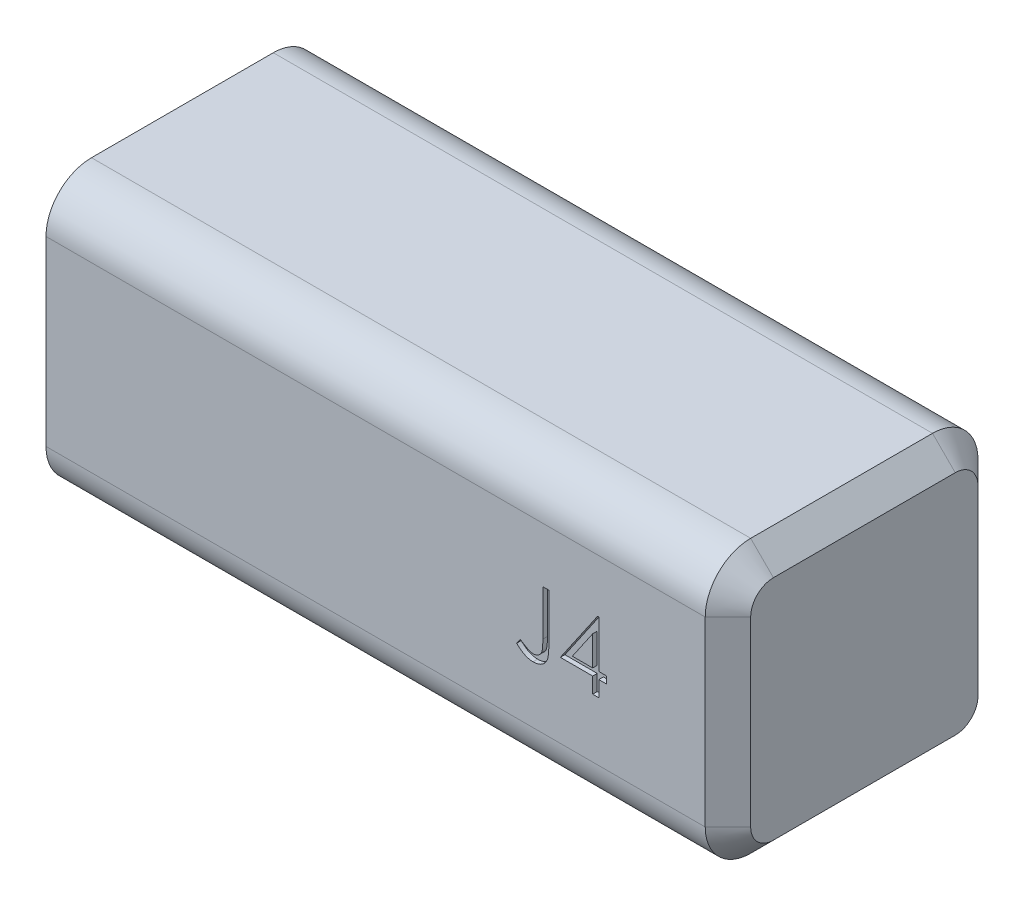
from build123d import *

# Parameters (mm, degrees)
BOSS_EXTRUDE1_DEPTH      = 30
BOSS_EXTRUDE1_DEPTH_BACK = 30
SKETCH1_W                = 150
SKETCH1_H                = 60
FILLET1_R                = 10
CHAMFER1_SIZE            = 5
CUT_EXTRUDE1_DEPTH       = 1
SKETCH14_R               = 22.5
CUT_EXTRUDE5_DEPTH       = 100


with BuildPart() as part:
    # Sketch1 → Boss-Extrude1 (new, two sides: drawn at the far end of the back side and taken through both)
    with BuildSketch(Plane.XY.offset(-BOSS_EXTRUDE1_DEPTH_BACK)):
        Rectangle(SKETCH1_W, SKETCH1_H)
    extrude(amount=BOSS_EXTRUDE1_DEPTH + BOSS_EXTRUDE1_DEPTH_BACK)

    # Fillet1
    fillet1_edges = [part.edges().sort_by_distance(p)[0] for p in [
        (0, -30, -30),
        (0, -30, 30),
        (0, 30, 30),
        (0, 30, -30),
    ]]
    fillet(fillet1_edges, radius=FILLET1_R)

    # Chamfer1
    chamfer1_edges = [part.edges().sort_by_distance(p)[0] for p in [
        (75, -30, 0),
        (75, -27.071067812, -27.071067812),
        (75, -27.071067812, 27.071067812),
        (75, 0, -30),
        (75, 0, 30),
        (75, 27.071067812, -27.071067812),
        (75, 27.071067812, 27.071067812),
        (75, 30, 0),
    ]]
    chamfer(chamfer1_edges, length=CHAMFER1_SIZE)

    # Sketch4 → Cut-Extrude1 (cut)
    # profile 1 of 2: a face of its own
    with BuildSketch(Plane.XY.offset(30)):
        with BuildLine():
            Line((34.285450061, 7.928114282), (35.631603908, 7.928114282))
            Line((35.631603908, 7.928114282), (35.631603908, -2.201092449))
            add(Edge.make_bspline(
                [(35.631603908, -2.201092449), (35.630258542, -2.388400324), (35.627675276, -2.748054301), (35.613470659, -3.266085283), (35.587184325, -3.73910251), (35.548891415, -4.168181568), (35.497804703, -4.551978234), (35.439343154, -4.893458025), (35.368574016, -5.189770949), (35.262003446, -5.522493902), (35.087257952, -5.887395922), (34.82425636, -6.281489425), (34.497544375, -6.626204042), (34.119111376, -6.925572863), (33.685649844, -7.164103854), (33.206086048, -7.335340333), (32.683372102, -7.439786861), (32.320804049, -7.450817883), (32.134007754, -7.456501103)],
                knots=[0, 0, 0, 0, 1.237770943, 2.376671248, 3.424123796, 4.367912054, 5.222547132, 5.982086412, 6.656319012, 7.234008312, 8.288027371, 9.317870876, 10.352700517, 11.413286737, 12.494591526, 13.606319346, 14.766767577, 16, 16, 16, 16], degree=3))
            add(Edge.make_bspline(
                [(32.134007754, -7.456501103), (31.988471933, -7.451869921), (31.695644221, -7.442551676), (31.259826898, -7.366601477), (30.825247001, -7.24953272), (30.389597935, -7.078093026), (29.944272615, -6.844926175), (29.483239701, -6.53984839), (29.000568882, -6.163427562), (28.682640513, -5.876122938), (28.516219292, -5.725731872)],
                knots=[0, 0, 0, 0, 0.848567217, 1.707373443, 2.573483905, 3.470863513, 4.432650262, 5.500696352, 6.691726801, 8, 8, 8, 8], degree=3))
            Line((28.516219292, -5.725731872), (29.309488523, -4.571885718))
            add(Edge.make_bspline(
                [(29.309488523, -4.571885718), (29.492500004, -4.698088845), (29.838049545, -4.936376804), (30.34592572, -5.242919377), (30.795913519, -5.505741515), (31.090269007, -5.639679854), (31.226555831, -5.701693411)],
                knots=[0, 0, 0, 0, 1.196737151, 2.259595785, 3.194191475, 4, 4, 4, 4], degree=3))
            add(Edge.make_bspline(
                [(31.226555831, -5.701693411), (31.30920288, -5.734091085), (31.471292148, -5.797630139), (31.719113918, -5.868541131), (31.96552122, -5.907294317), (32.128882765, -5.91450003), (32.209127946, -5.918039564)],
                knots=[0, 0, 0, 0, 1.051806502, 2.062826769, 3.048436908, 4, 4, 4, 4], degree=3))
            add(Edge.make_bspline(
                [(32.209127946, -5.918039564), (32.312768468, -5.913656415), (32.517627566, -5.904992544), (32.815330398, -5.82849565), (33.100150531, -5.711733923), (33.361877636, -5.540771235), (33.603100723, -5.337493718), (33.802141404, -5.091682252), (33.968072452, -4.819256606), (34.067928281, -4.561378947), (34.131548732, -4.326193389), (34.171927133, -4.110051378), (34.207235678, -3.857359327), (34.238013757, -3.567815611), (34.256032917, -3.240840545), (34.2762498, -2.877394218), (34.283558061, -2.476560309), (34.284800151, -2.197084801), (34.285450061, -2.050852064)],
                knots=[0, 0, 0, 0, 0.997221856, 1.971139923, 2.944579524, 3.951425367, 4.971190333, 5.972282193, 6.985401279, 8.033996657, 8.624075553, 9.332086008, 10.151144245, 11.082816738, 12.137127781, 13.306538797, 14.590673636, 16, 16, 16, 16], degree=3))
            Line((34.285450061, -2.050852064), (34.285450061, 7.928114282))
        make_face()
    # profile 2 of 2: a face of its own
    with BuildSketch(Plane.XY.offset(30)):
        Polygon((46.319704869, 8.312729666), (46.593142369, 8.312729666), (46.593142369, -2.071885718), (48.3239116, -2.071885718), (48.3239116, -3.610347257), (46.593142369, -3.610347257), (46.593142369, -7.071885718), (45.246988523, -7.071885718), (45.246988523, -3.610347257), (38.131603908, -3.610347257), align=None)
        Polygon((45.246988523, -2.071885718), (45.246988523, 4.442537359), (40.775834677, -2.071885718), align=None, mode=Mode.SUBTRACT)
    extrude(amount=-CUT_EXTRUDE1_DEPTH, mode=Mode.SUBTRACT)

    # Sketch14 → Cut-Extrude5 (cut)
    with BuildSketch(Plane.ZY.offset(75)):
        Circle(SKETCH14_R)
    extrude(amount=-CUT_EXTRUDE5_DEPTH, mode=Mode.SUBTRACT)


solid = part.part
